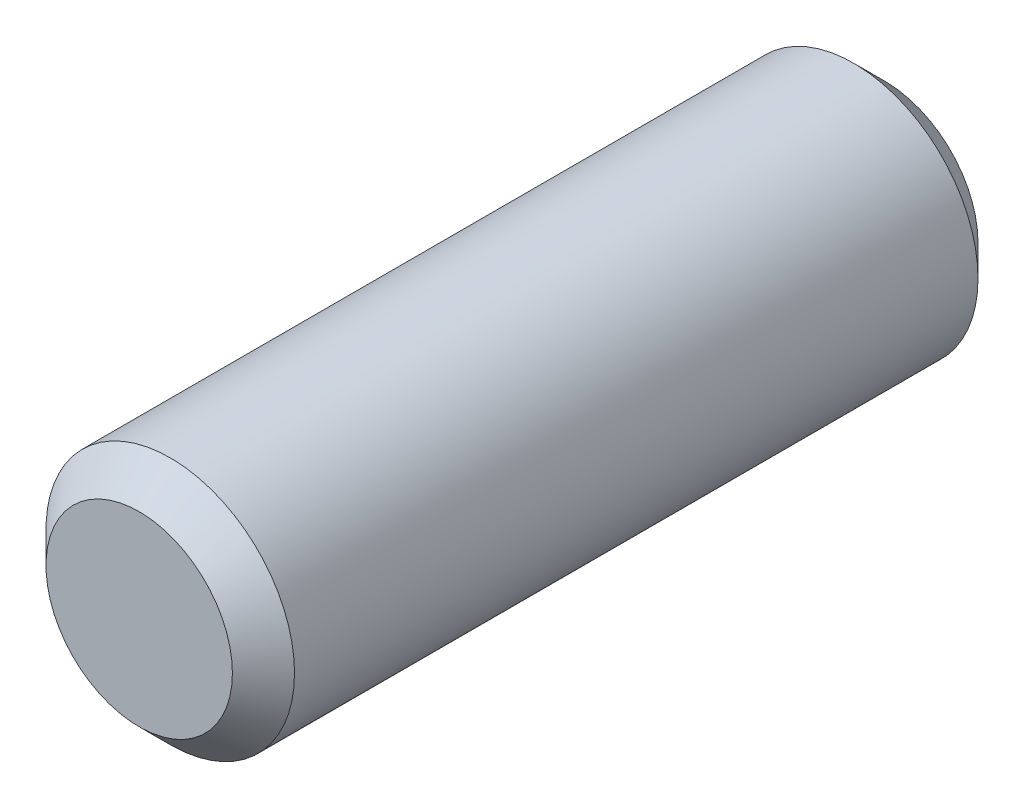
from build123d import *

# Parameters (mm, degrees)
SKETCH1_R           = 4
BOSS_EXTRUDE1_DEPTH = 12
CHAMFER1_SIZE       = 1


with BuildPart() as part:
    # Sketch1 → Boss-Extrude1 (new, symmetric)
    with BuildSketch(Plane(origin=(0, 0, 0), x_dir=(0, 1, 0), z_dir=(0, 0, 1))):
        with Locations(Location((0, 0, 0), (0, 0, 270))):
            Circle(SKETCH1_R)
    extrude(amount=BOSS_EXTRUDE1_DEPTH, both=True)

    # Chamfer1
    chamfer1_edges = [part.edges().sort_by_distance(p)[0] for p in [
        (-4, 0, -12),
        (-4, 0, 12),
    ]]
    chamfer(chamfer1_edges, length=CHAMFER1_SIZE)


solid = part.part
